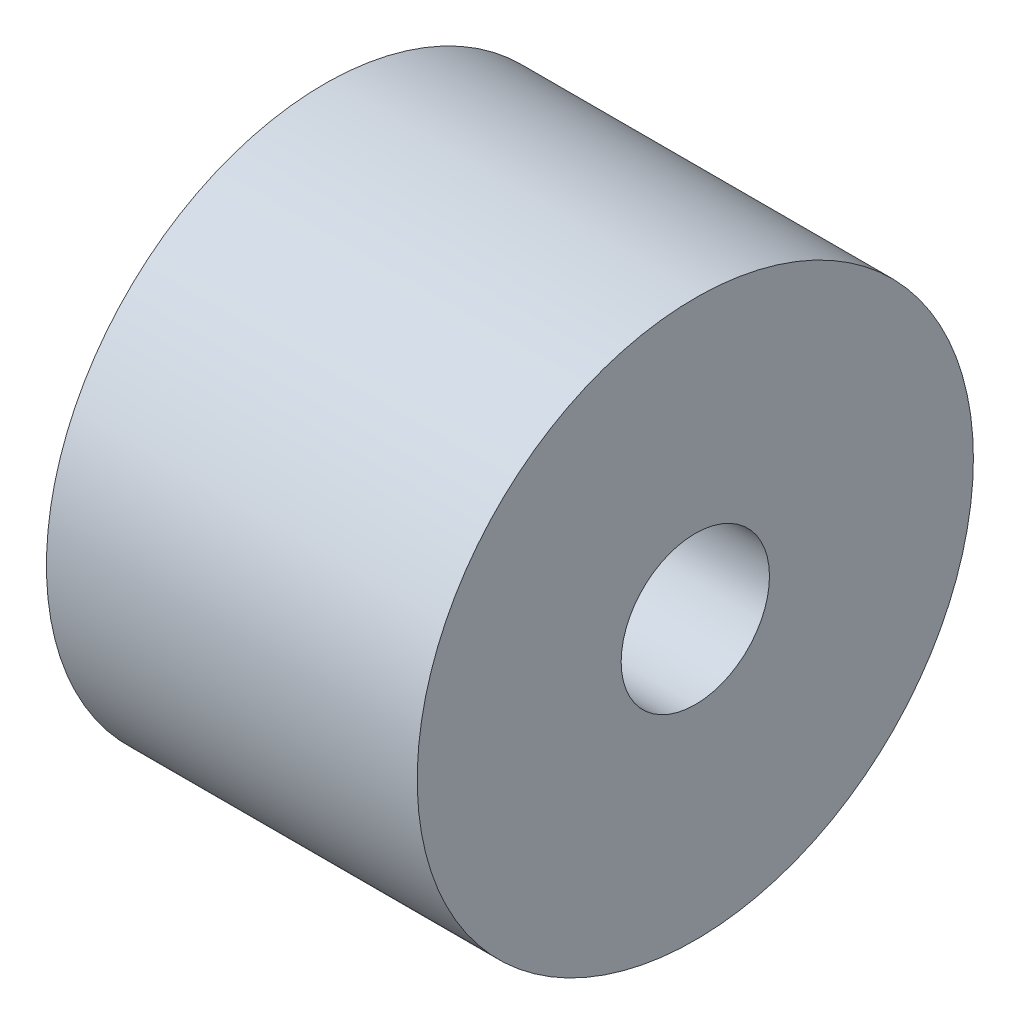
from build123d import *

# Parameters (mm, degrees)
ESQUISSE1_R             = 15
ESQUISSE1_R_2           = 4
BOSS_EXTRU_1_DEPTH      = 20
ENL_V_MAT_EXTRU_1_DEPTH = 8


with BuildPart() as part:
    # Esquisse1 → Boss.-Extru.1 (new body)
    with BuildSketch(Plane(origin=(0, 0, 0), x_dir=(0, 0, -1), z_dir=(1, 0, 0))):
        with Locations((-27.152557625, -173.602016712)):
            Circle(ESQUISSE1_R)
        with Locations((-27.152557625, -173.602016712)):
            Circle(ESQUISSE1_R_2, mode=Mode.SUBTRACT)
    extrude(amount=BOSS_EXTRU_1_DEPTH)

    # Esquisse2 → Enlèv. mat.-Extru.1 (cut)
    with BuildSketch(Plane.ZY):
        Polygon((21.82354936, -178.887374244), (29.065307384, -180.859752013), (34.394315649, -175.57439448), (32.48156589, -168.31665918), (25.239807867, -166.344281411), (19.910799602, -171.629638944), align=None)
    extrude(amount=-ENL_V_MAT_EXTRU_1_DEPTH, mode=Mode.SUBTRACT)


solid = part.part
